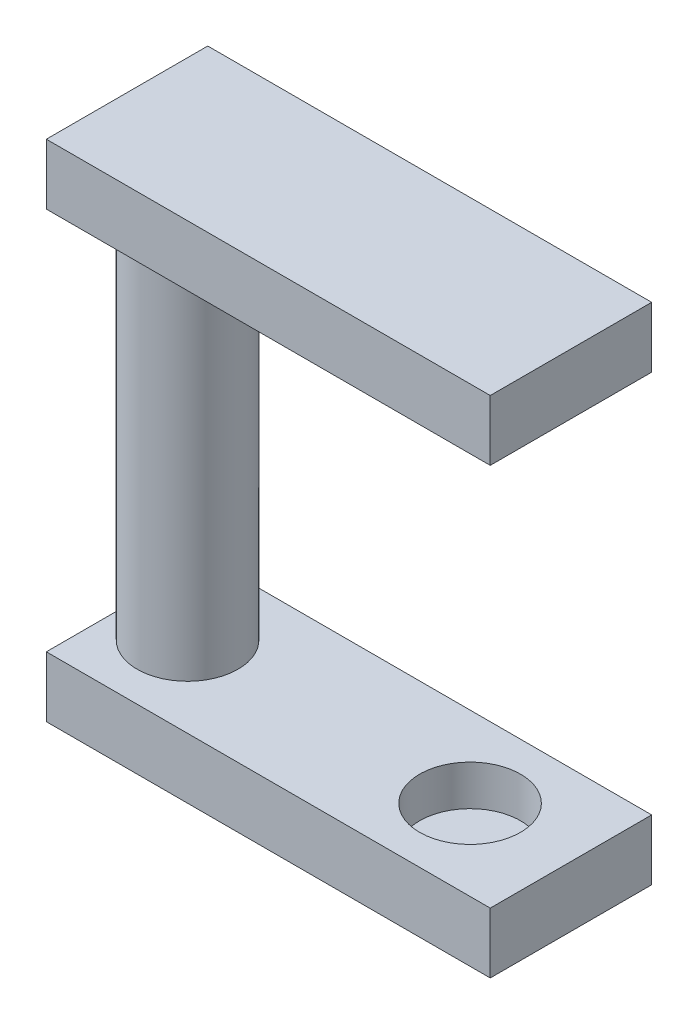
from build123d import *

# Parameters (mm, degrees)
SKETCH1_R           = 6.35
BOSS_EXTRUDE1_DEPTH = 48.26
SKETCH2_W           = 55.88
SKETCH2_H           = 20.32
BOSS_EXTRUDE2_DEPTH = 7.62
SKETCH3_W           = 55.88
SKETCH3_H           = 20.32
BOSS_EXTRUDE3_DEPTH = 7.62
SKETCH5_R           = 6.35
CUT_EXTRUDE1_DEPTH  = 5.08
CUT_EXTRUDE2_START  = -5.08
SKETCH6_R           = 6.35
CUT_EXTRUDE2_DEPTH  = 5.08


with BuildPart() as part:
    # Sketch1 → Boss-Extrude1 (new body)
    with BuildSketch(Plane(origin=(0, 0, 0), x_dir=(1, 0, 0), z_dir=(0, 1, 0))):
        with Locations(Location((0, 0, 0), (0, 0, 90))):
            Circle(SKETCH1_R)
    extrude(amount=BOSS_EXTRUDE1_DEPTH)

    # Sketch3 → Boss-Extrude3 (add)
    with BuildSketch(Plane.XZ):
        with Locations((20.32, 0)):
            Rectangle(SKETCH3_W, SKETCH3_H)
    extrude(amount=BOSS_EXTRUDE3_DEPTH)

    # Sketch5 → Cut-Extrude1 (cut)
    with BuildSketch(Plane(origin=(0, 0, 0), x_dir=(1, 0, 0), z_dir=(0, 1, 0))):
        with Locations(Location((35.56, 0, 0), (0, 0, 270))):
            Circle(SKETCH5_R)
    extrude(amount=-CUT_EXTRUDE1_DEPTH, mode=Mode.SUBTRACT)


with BuildPart() as body_2:
    # Sketch2 → Boss-Extrude2 (new body)
    with BuildSketch(Plane(origin=(0, 48.26, 0), x_dir=(1, 0, 0), z_dir=(0, 1, 0))):
        with Locations((20.32, 0)):
            Rectangle(SKETCH2_W, SKETCH2_H)
    extrude(amount=BOSS_EXTRUDE2_DEPTH)

    # Sketch6 → Cut-Extrude2 (cut)
    with BuildSketch(Plane.XZ.offset(-48.26).offset(CUT_EXTRUDE2_START)):
        with Locations(Location((35.56, 0, 0), (0, 0, 270))):
            Circle(SKETCH6_R)
    extrude(amount=CUT_EXTRUDE2_DEPTH, mode=Mode.SUBTRACT)


solid = Compound([part.part, body_2.part])
